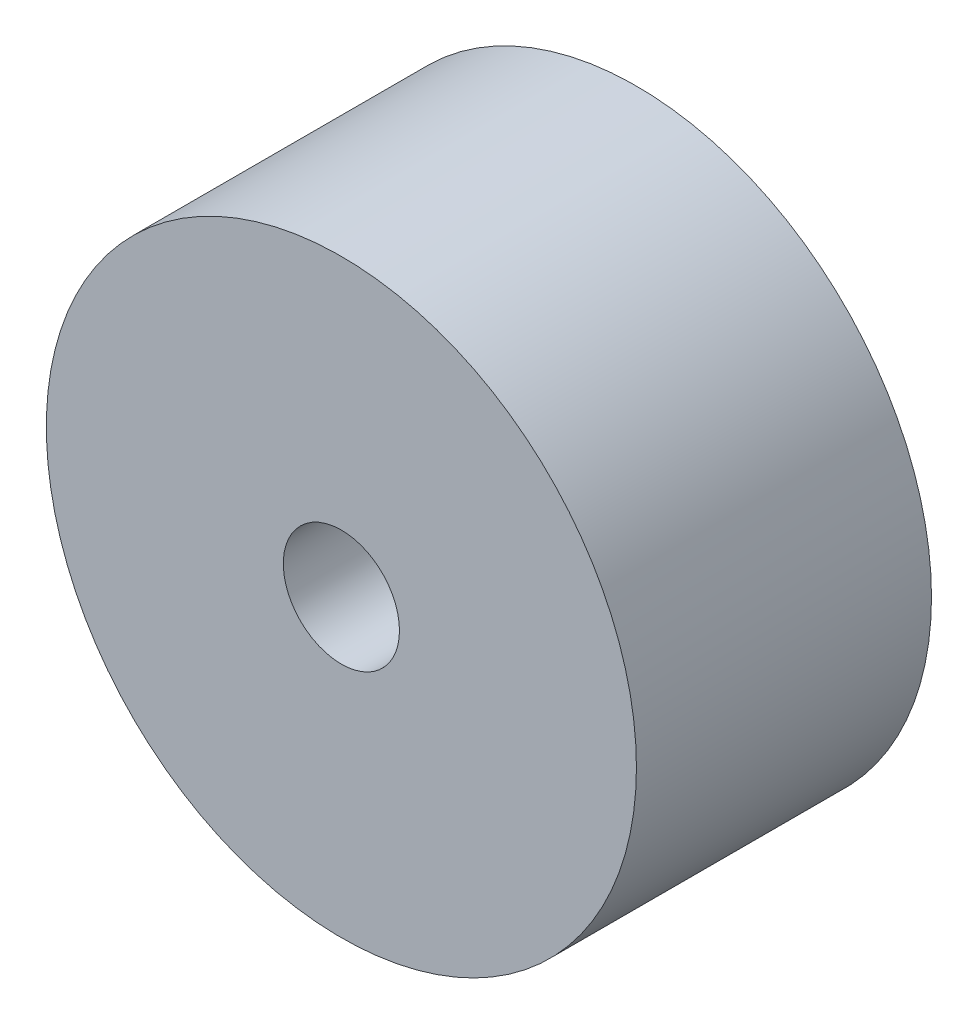
from build123d import *

# Parameters (mm, degrees)
SKETCH1_R           = 12.7
BOSS_EXTRUDE1_DEPTH = 12.7
SKETCH2_R           = 2.5
CUT_EXTRUDE1_DEPTH  = 16


with BuildPart() as part:
    # Sketch1 → Boss-Extrude1 (new body)
    with BuildSketch(Plane.XY):
        Circle(SKETCH1_R)
    extrude(amount=BOSS_EXTRUDE1_DEPTH)

    # Sketch2 → Cut-Extrude1 (cut)
    with BuildSketch(Plane.XY.offset(12.7)):
        Circle(SKETCH2_R)
    extrude(amount=-CUT_EXTRUDE1_DEPTH, mode=Mode.SUBTRACT)


solid = part.part
